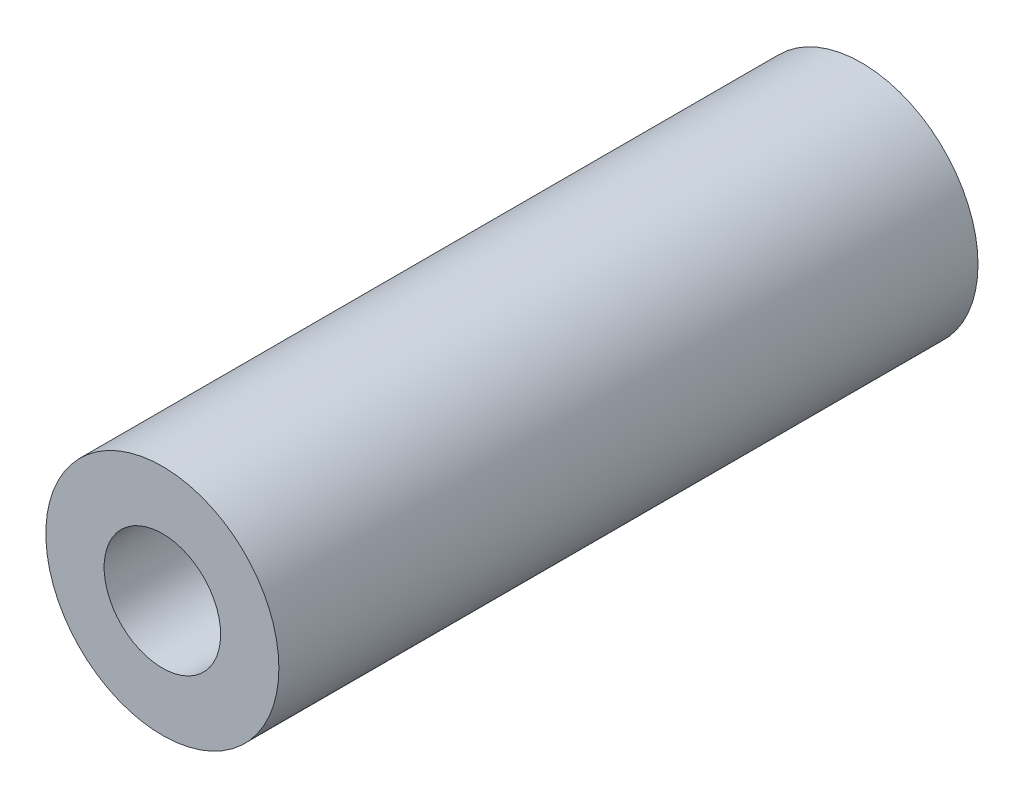
from build123d import *

# Parameters (mm, degrees)
SKETCH1_R           = 2.5
SKETCH1_R_2         = 1.25
BOSS_EXTRUDE1_DEPTH = 15


with BuildPart() as part:
    # Sketch1 → Boss-Extrude1 (new body)
    with BuildSketch(Plane.XY):
        with Locations((-32.5, 171.471148243)):
            Circle(SKETCH1_R)
        with Locations((-32.5, 171.471148243)):
            Circle(SKETCH1_R_2, mode=Mode.SUBTRACT)
    extrude(amount=BOSS_EXTRUDE1_DEPTH)


solid = part.part
